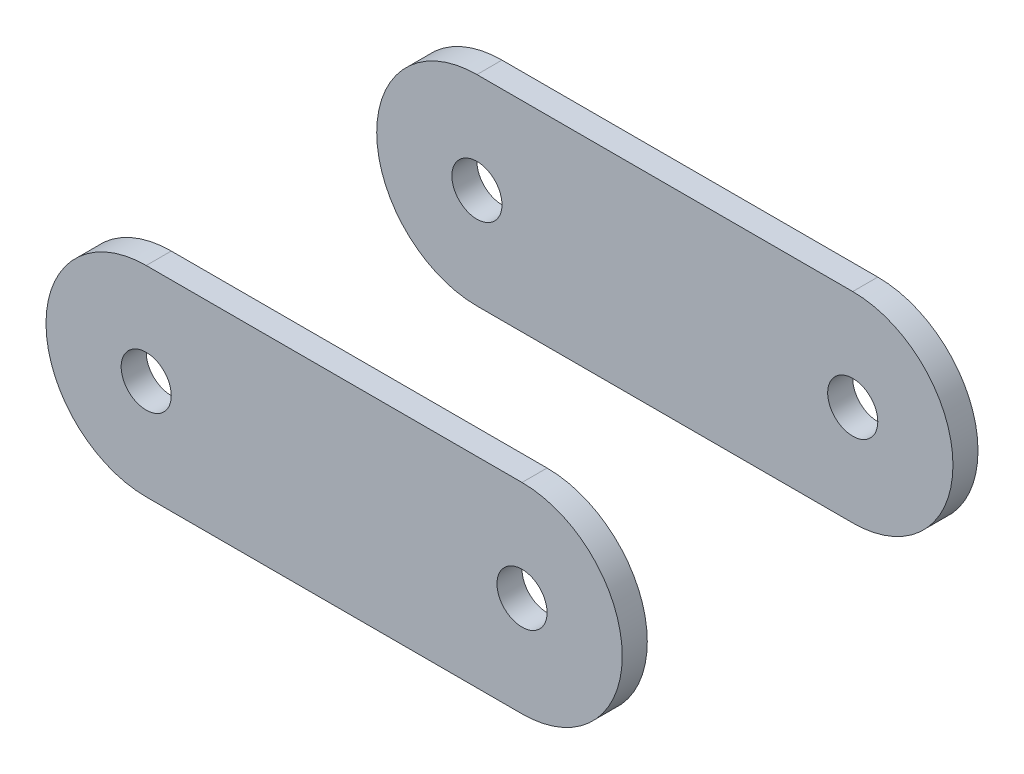
from build123d import *

# Parameters (mm, degrees)
ESQUISSE1_R                = 5
BOSS_EXTRU_1_DEPTH         = 5
R_P_TITION_LIN_AIRE1_COUNT = 2
R_P_TITION_LIN_AIRE1_PITCH = 66


with BuildPart() as part:
    # Esquisse1 → Boss.-Extru.1 (new body)
    with BuildSketch(Plane.XY):
        with BuildLine():
            Line((0, 0), (75, 0))
            ThreePointArc((75, 0), (95, 20), (75, 40))
            Line((75, 40), (0, 40))
            ThreePointArc((0, 40), (-20, 20), (0, 0))
        make_face()
        with Locations((0, 20)):
            Circle(ESQUISSE1_R, mode=Mode.SUBTRACT)
        with Locations((75, 20)):
            Circle(ESQUISSE1_R, mode=Mode.SUBTRACT)
    extrude(amount=BOSS_EXTRU_1_DEPTH)


with BuildPart() as r_p_tition_lin_aire1_1:
    # Répétition linéaire1: pattern copy
    add(part.part.moved(Location(Vector(0, 0, -1) * (1 * R_P_TITION_LIN_AIRE1_PITCH))))


solid = Compound([part.part, r_p_tition_lin_aire1_1.part])
